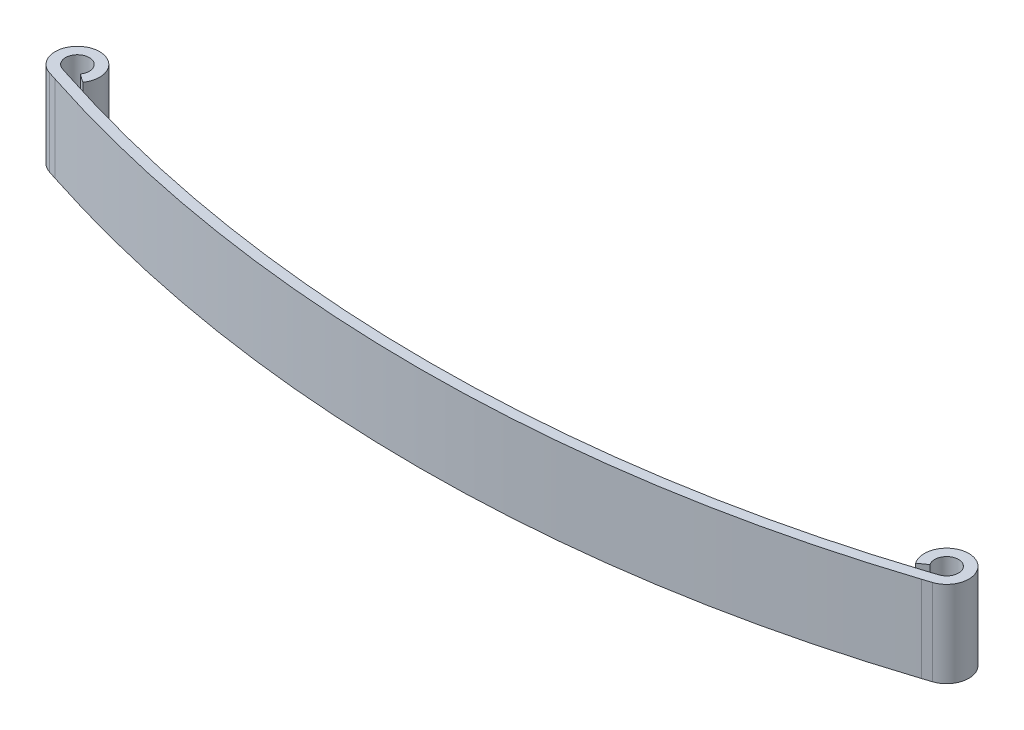
from build123d import *

# Parameters (mm, degrees)
BOSS_EXTRUDE2_DEPTH = 100


with BuildPart() as part:
    # Sketch1 → Boss-Extrude2 (new body)
    with BuildSketch(Plane(origin=(0, 0, 0), x_dir=(1, 0, 0), z_dir=(0, 1, 0))):
        with BuildLine():
            Line((721.456257489, -1539.318312933), (730.967103777, -1536.229008333))
            ThreePointArc((730.967103777, -1536.229008333), (731.064137297, -1509.9715551), (715.399570091, -1531.04486998))
            Line((715.399570091, -1531.04486998), (705.590054586, -1537.956700821))
            ThreePointArc((705.590054586, -1537.956700821), (734.855553229, -1498.586250307), (734.674269296, -1547.642023878))
            Line((734.674269296, -1547.642023878), (725.163423008, -1550.731328477))
            ThreePointArc((725.163423008, -1550.731328477), (221.45625749, -1630.487216054), (-282.250908028, -1550.731328477))
            Line((-282.250908028, -1550.731328477), (-291.761754316, -1547.642023878))
            ThreePointArc((-291.761754316, -1547.642023878), (-291.943038249, -1498.586250307), (-262.677539607, -1537.956700821))
            Line((-262.677539607, -1537.956700821), (-272.487055111, -1531.04486998))
            ThreePointArc((-272.487055111, -1531.04486998), (-288.151622317, -1509.9715551), (-288.054588797, -1536.229008333))
            Line((-288.054588797, -1536.229008333), (-278.54374251, -1539.318312933))
            ThreePointArc((-278.54374251, -1539.318312933), (221.45625749, -1618.487216054), (721.456257489, -1539.318312933))
        make_face()
    extrude(amount=BOSS_EXTRUDE2_DEPTH)


solid = part.part
